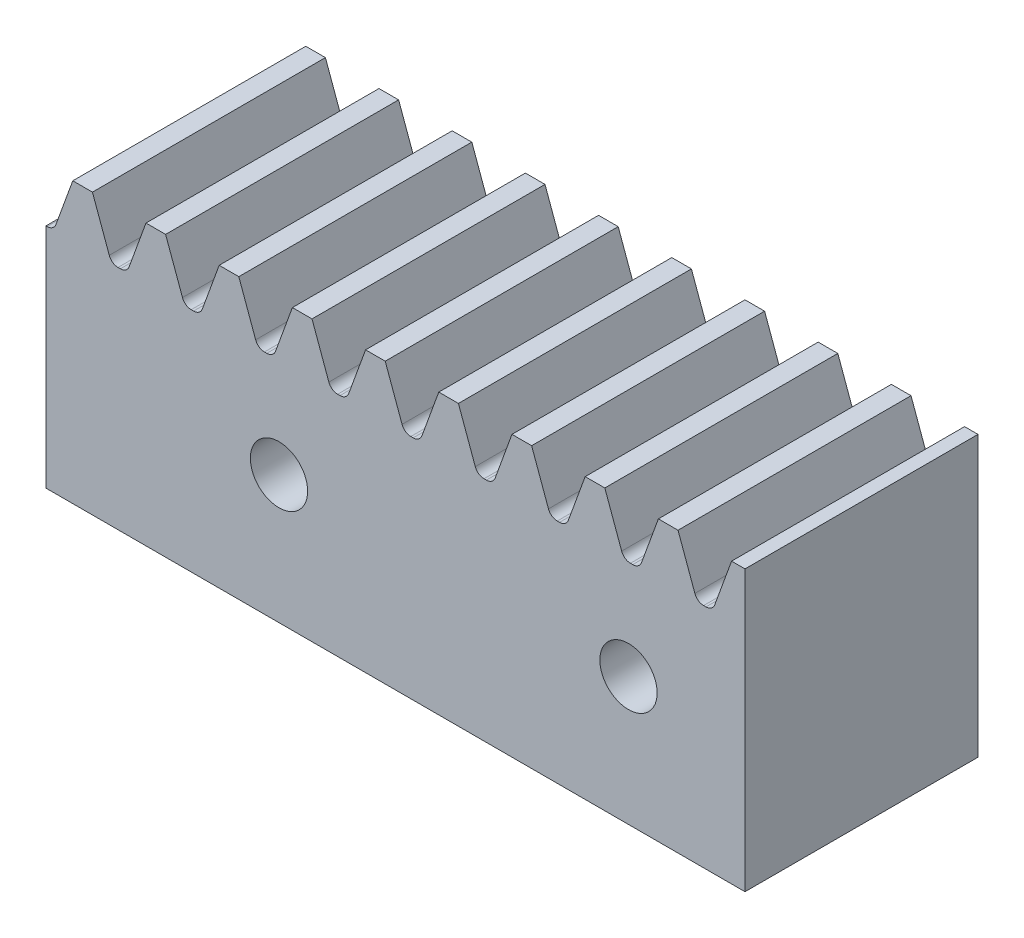
from build123d import *

# Parameters (mm, degrees)
SKETCH1_W           = 30
SKETCH1_H           = 12
BOSS_EXTRUDE1_DEPTH = 5
CUT_EXTRUDE1_DEPTH  = 34.823069051
LPATTERN1_COUNT     = 10
LPATTERN1_PITCH     = 3.141592654
TAP1_D              = 2.459
TAP1_DEPTH          = 6
TAP1_TIP            = 0.738758131
TAP3_D              = 2.459
TAP3_DEPTH          = 6
TAP3_TIP            = 0.738758131


with BuildPart() as part:
    # Sketch1 → Boss-Extrude1 (new, symmetric)
    with BuildSketch(Plane.XY):
        with Locations((15, 6)):
            Rectangle(SKETCH1_W, SKETCH1_H)
    extrude(amount=BOSS_EXTRUDE1_DEPTH, both=True)

    # Sketch2 → Cut-Extrude1 (cut, through all)
    with BuildSketch(Plane.XY.offset(5)):
        with BuildLine():
            Line((-1.149368398, 12), (1.149368398, 12))
            Line((1.149368398, 12), (0.426229404, 10.013191943))
            ThreePointArc((0.426229404, 10.013191943), (0.27978293, 9.822339182), (0.050352355, 9.75))
            Line((0.050352355, 9.75), (-0.050352355, 9.75))
            ThreePointArc((-0.050352355, 9.75), (-0.27978293, 9.822339182), (-0.426229404, 10.013191943))
            Line((-0.426229404, 10.013191943), (-1.149368398, 12))
        make_face()
    cut_extrude1 = extrude(amount=-CUT_EXTRUDE1_DEPTH, mode=Mode.SUBTRACT)

    # LPattern1: Cut-Extrude1 ×10
    with Locations(*[(i * LPATTERN1_PITCH, 0, 0) for i in range(1, LPATTERN1_COUNT)]):
        add(cut_extrude1, mode=Mode.SUBTRACT)

    # Tap1
    with Locations(Plane(origin=(-45.41658703, 4.630780207, 5), x_dir=(-1, 0, 0), z_dir=(0, 0, 1))):
        with Locations((-55.41658703, -0.869219793)):
            Hole(TAP1_D / 2, depth=TAP1_DEPTH)
            with Locations((0, 0, -(TAP1_DEPTH + TAP1_TIP / 2))):  # 118° drill point
                Cone(0, TAP1_D / 2, TAP1_TIP, mode=Mode.SUBTRACT)

    # Tap3
    with Locations(Plane(origin=(-24.792169361, 5.708678804, 5), x_dir=(-1, 0, 0), z_dir=(0, 0, 1))):
        with Locations((-49.792169361, 0.208678804)):
            Hole(TAP3_D / 2, depth=TAP3_DEPTH)
            with Locations((0, 0, -(TAP3_DEPTH + TAP3_TIP / 2))):  # 118° drill point
                Cone(0, TAP3_D / 2, TAP3_TIP, mode=Mode.SUBTRACT)


solid = part.part
